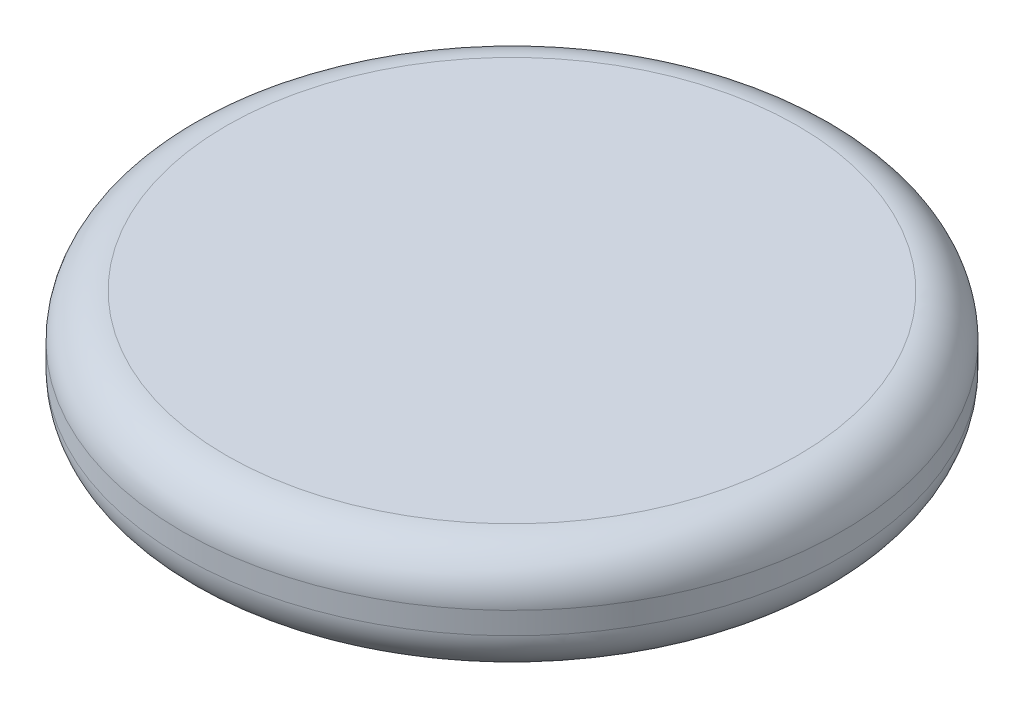
from build123d import *

# Parameters (mm, degrees)
SKETCH2_R           = 75
BOSS_EXTRUDE1_DEPTH = 25
FILLET1_R           = 10
SCALE1_SCALE        = 0.333333333


with BuildPart() as part:
    # Sketch2 → Boss-Extrude1 (new body)
    with BuildSketch(Plane(origin=(0, 0, 0), x_dir=(1, 0, 0), z_dir=(0, 1, 0))):
        with Locations(Location((0, 0, 0), (0, 0, 270))):
            Circle(SKETCH2_R)
    extrude(amount=BOSS_EXTRUDE1_DEPTH)

    # Fillet1
    fillet1_edges = [part.edges().sort_by_distance(p)[0] for p in [
        (0, 0, -75),
        (0, 25, -75),
    ]]
    fillet(fillet1_edges, radius=FILLET1_R)


with BuildPart() as part_1:
    # Scale1: scaled about (0, 0, 0)
    add(part.part.scale(SCALE1_SCALE))


solid = part_1.part
